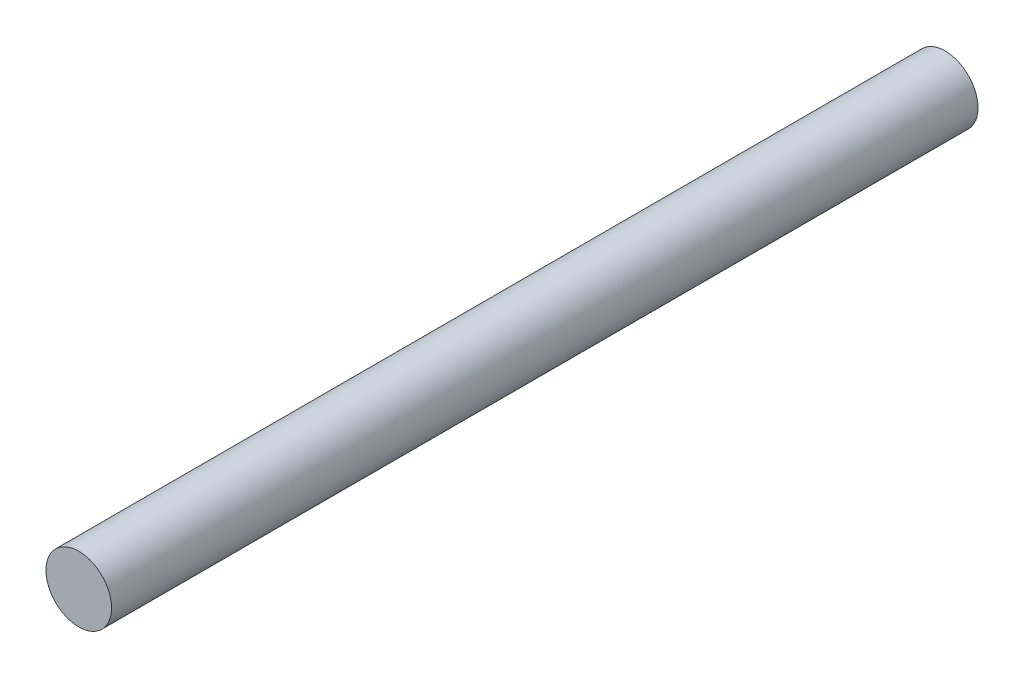
from build123d import *

# Parameters (mm, degrees)
SKETCH1_R           = 2.5
BOSS_EXTRUDE1_DEPTH = 66


with BuildPart() as part:
    # Sketch1 → Boss-Extrude1 (new body)
    with BuildSketch(Plane.XY):
        Circle(SKETCH1_R)
    extrude(amount=BOSS_EXTRUDE1_DEPTH)


solid = part.part
